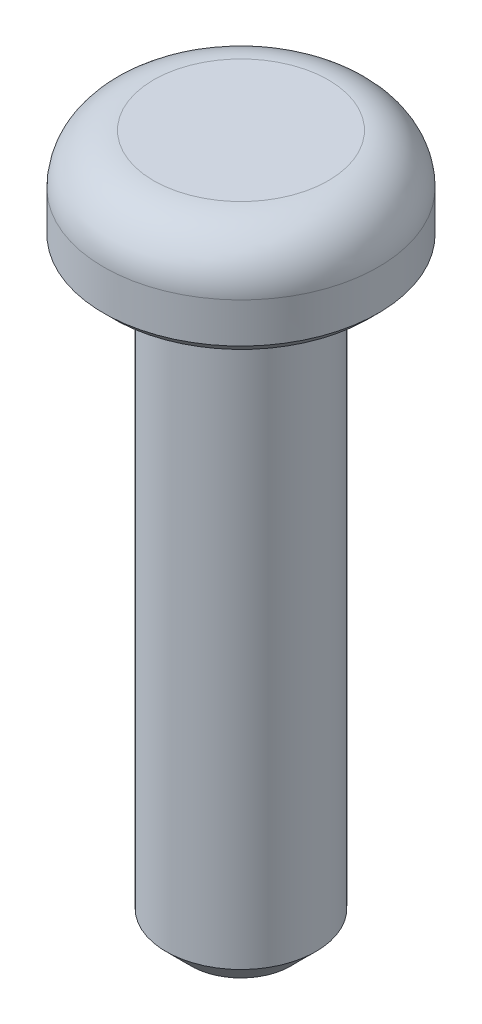
from build123d import *

# Parameters (mm, degrees)
FILLET1_R     = 1
CHAMFER1_SIZE = 0.5
CHAMFER2_SIZE = 0.2


with BuildPart() as part:
    # Sketch1 → Revolve1 (revolve)
    with BuildSketch(Plane.XY, mode=Mode.PRIVATE) as revolve1_sk:
        Polygon((0, 0), (0, 14), (2.75, 14), (2.75, 12), (1.5, 12), (1.5, 0), align=None)
    revolve(revolve1_sk.sketch.rotate(Axis((0, 0, 0), (0, 1, 0)), 90), axis=Axis((0, 0, 0), (0, 1, 0)))

    # Fillet1
    fillet1_edges = [part.edges().sort_by_distance(p)[0] for p in [
        (0, 14, 2.75),
    ]]
    fillet(fillet1_edges, radius=FILLET1_R)

    # Chamfer1
    chamfer1_edges = [part.edges().sort_by_distance(p)[0] for p in [
        (0, 0, 1.5),
    ]]
    chamfer(chamfer1_edges, length=CHAMFER1_SIZE)

    # Chamfer2
    chamfer2_edges = [part.edges().sort_by_distance(p)[0] for p in [
        (0, 12, 2.75),
    ]]
    chamfer(chamfer2_edges, length=CHAMFER2_SIZE)


solid = part.part
